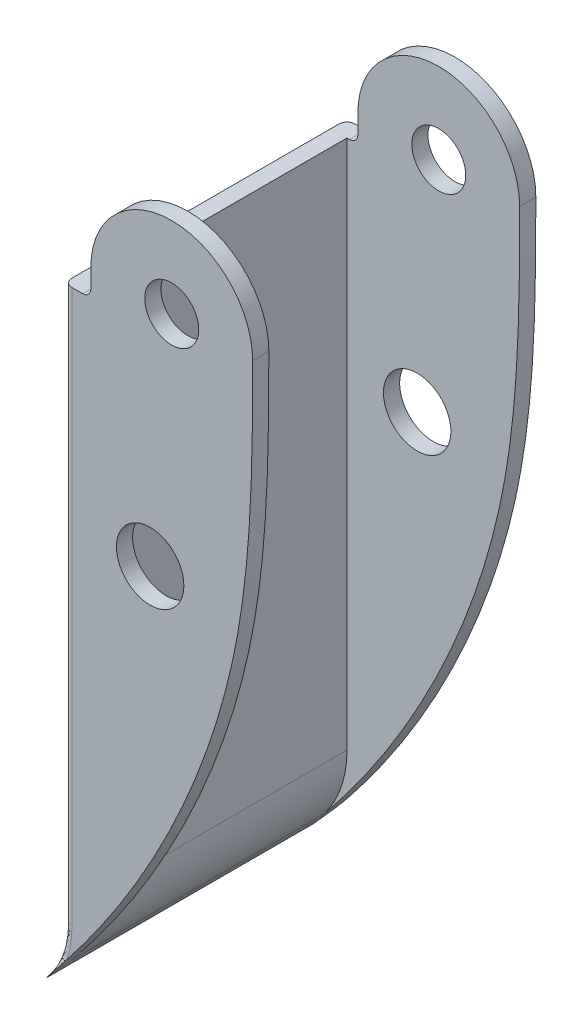
from build123d import *

# Parameters (mm, degrees)
SKETCH_1_R          = 1
EXTRUDE_1_DEPTH     = 10.5
SKETCH_2_W          = 9.3
SKETCH_2_H          = 27
CUT_EXTRUDE_1_DEPTH = 10.5
FILLET_1_R          = 4
FILLET_2_R          = 0.3
SKETCH_3_R          = 1.25
CUT_EXTRUDE_2_DEPTH = 19


with BuildPart() as part:
    # 草图1 → 凸台-拉伸1 (new body)
    with BuildSketch(Plane.XY):
        with BuildLine():
            ThreePointArc((7, 0), (4, 3), (1, 0))
            Line((1, 0), (1, -1))
            Line((1, -1), (0, -1))
            Line((0, -1), (0, -21.5))
            add(Edge.make_bspline(
                [(0, -21.5), (0, -22.851375424), (-0.954237794, -23.948160578)],
                knots=[0, 0, 0, 0.976850958, 0.976850958, 0.976850958], degree=2))
            add(Edge.make_bspline(
                [(7, 0), (7, -3.461774358), (6.888539552, -11.820950193), (2.535059444, -19.986776398), (-0.954237794, -23.948160578)],
                knots=[0, 0, 0, 0, 0.379767853, 0.997303013, 0.997303013, 0.997303013, 0.997303013], degree=3))
        make_face()
        with Locations(Location((4, 0, 0), (0, 0, 180))):
            Circle(SKETCH_1_R, mode=Mode.SUBTRACT)
    extrude(amount=EXTRUDE_1_DEPTH)

    # 草图2 → 切除-拉伸1 (cut)
    with BuildSketch(Plane.ZY.offset(-0.6)):
        with Locations((5.25, -10.44816051)):
            Rectangle(SKETCH_2_W, SKETCH_2_H)
    extrude(amount=-CUT_EXTRUDE_1_DEPTH, mode=Mode.SUBTRACT)

    # 圆角1
    fillet_1_edges = [part.edges().sort_by_distance(p)[0] for p in [
        (0.6, -22.041590232, 5.25),
    ]]
    fillet(fillet_1_edges, radius=FILLET_1_R)

    # 圆角2
    fillet_2_edges = [part.edges().sort_by_distance(p)[0] for p in [
        (0, -11.25, 10.5),
        (-0.248254444, -22.812327553, 0),
        (0, -11.25, 0),
        (1, -1, 10.2),
        (-0.248254444, -22.812327553, 10.5),
        (1, -1, 0.3),
    ]]
    fillet(fillet_2_edges, radius=FILLET_2_R)

    # 草图3 → 切除-拉伸2 (cut)
    with BuildSketch(Plane(origin=(0, 0, 0), x_dir=(-1, 0, 0), z_dir=(0, 0, -1))):
        with Locations(Location((-3.2, -8.5, 0), (0, 0, 270))):
            Circle(SKETCH_3_R)
    extrude(amount=-CUT_EXTRUDE_2_DEPTH, mode=Mode.SUBTRACT)


solid = part.part
